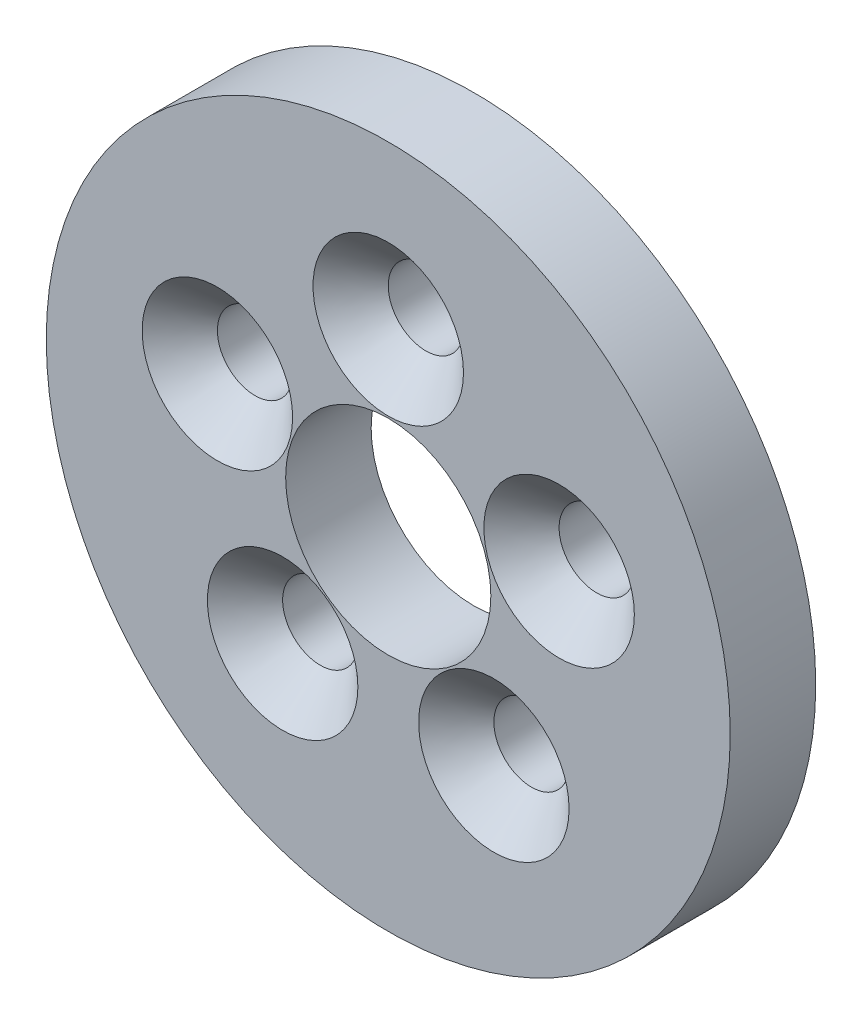
from build123d import *

# Parameters (mm, degrees)
SKETCH1_R                                       = 10
SKETCH1_R_2                                     = 3
BOSS_EXTRUDE1_DEPTH                             = 2.5
CSK_FOR_M2_FLAT_HEAD_MACHINE_SCREW3_D           = 2.2
CSK_FOR_M2_FLAT_HEAD_MACHINE_SCREW3_CSINK_D     = 4.4
CSK_FOR_M2_FLAT_HEAD_MACHINE_SCREW3_CSINK_ANGLE = 90


with BuildPart() as part:
    # Sketch1 → Boss-Extrude1 (new body)
    # profile 1 of 2: a face of its own
    with BuildSketch(Plane.XY):
        Circle(SKETCH1_R)
        Polygon((4.996174644, 1.623355548), (0, 5.253288904), (-4.996174644, 1.623355548), (-3.087805744, -4.25), (3.087805744, -4.25), align=None, mode=Mode.SUBTRACT)
    # profile 2 of 2: a face of its own
    with BuildSketch(Plane.XY):
        Polygon((3.087805744, -4.25), (4.996174644, 1.623355548), (0, 5.253288904), (-4.996174644, 1.623355548), (-3.087805744, -4.25), align=None)
        Circle(SKETCH1_R_2, mode=Mode.SUBTRACT)
    extrude(amount=BOSS_EXTRUDE1_DEPTH)

    # CSK for M2 Flat Head Machine Screw3 (through all)
    with Locations(Plane.XY.offset(2.5)):
        with Locations((0, 5.253288904), (4.996174644, 1.623355548), (3.087805744, -4.25), (-4.996174644, 1.623355548), (-3.087805744, -4.25)):
            CounterSinkHole(CSK_FOR_M2_FLAT_HEAD_MACHINE_SCREW3_D / 2, CSK_FOR_M2_FLAT_HEAD_MACHINE_SCREW3_CSINK_D / 2, counter_sink_angle=CSK_FOR_M2_FLAT_HEAD_MACHINE_SCREW3_CSINK_ANGLE)


solid = part.part
